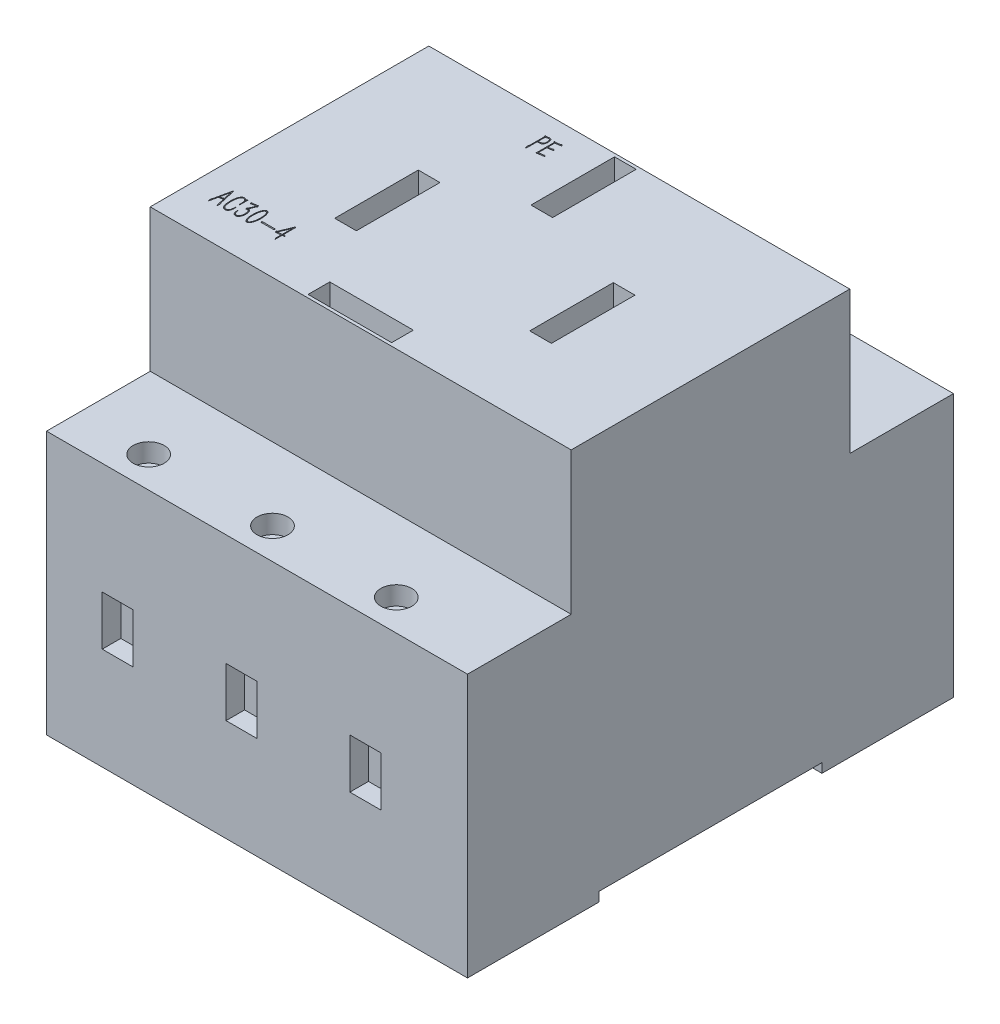
from build123d import *

# Parameters (mm, degrees)
EXTRUDE_1_DEPTH        = 34
SKETCH_2_R             = 2.5
CUT_EXTRUDE_1_DEPTH    = 3
SKETCH_3_W             = 5
SKETCH_3_H             = 8
CUT_EXTRUDE_2_DEPTH    = 3
PATTERN_LINEAR_1_COUNT = 3
PATTERN_LINEAR_1_PITCH = 20
SKETCH_5_R             = 3
CUT_EXTRUDE_3_DEPTH    = 3
SKETCH_6_W             = 5
SKETCH_6_H             = 8
CUT_EXTRUDE_4_DEPTH    = 3
SKETCH_8_W             = 3.5
SKETCH_8_H             = 13.5
SKETCH_8_W_2           = 13.5
SKETCH_8_H_2           = 3.5
CUT_EXTRUDE_5_DEPTH    = 5
SKETCH_9_W             = 2.164287236
SKETCH_9_H             = 0.217025357
CUT_EXTRUDE_6_DEPTH    = 0.3


with BuildPart() as part:
    # 草图1 → 凸台-拉伸1 (new, symmetric)
    with BuildSketch(Plane(origin=(0, 0, 0), x_dir=(0, 0, -1), z_dir=(1, 0, 0))):
        Polygon((-22.5, 32.75), (-22.5, 9.75), (-39.25, 9.75), (-39.25, -32.75), (-22.5, -32.75), (-18, -32.75), (-18, -31.25), (18, -31.25), (18, -32.75), (22.5, -32.75), (39.25, -32.75), (39.25, 9.75), (22.5, 9.75), (22.5, 32.75), align=None)
    extrude(amount=EXTRUDE_1_DEPTH, both=True)

    # 草图2 → 切除-拉伸1 (cut)
    with BuildSketch(Plane(origin=(0, 9.75, 0), x_dir=(1, 0, 0), z_dir=(0, 1, 0))):
        with Locations((-22.5, -34.25)):
            Circle(SKETCH_2_R)
    cut_extrude_1 = extrude(amount=-CUT_EXTRUDE_1_DEPTH, mode=Mode.SUBTRACT)

    # 草图3 → 切除-拉伸2 (cut)
    with BuildSketch(Plane.XY.offset(39.25)):
        with Locations((-22.5, -12.25)):
            Rectangle(SKETCH_3_W, SKETCH_3_H)
    cut_extrude_2 = extrude(amount=-CUT_EXTRUDE_2_DEPTH, mode=Mode.SUBTRACT)

    # 阵列(线性)1: 切除-拉伸1, 切除-拉伸2 ×3
    with Locations(*[(i * PATTERN_LINEAR_1_PITCH, 0, 0) for i in range(1, PATTERN_LINEAR_1_COUNT)]):
        add(cut_extrude_1, mode=Mode.SUBTRACT)
        add(cut_extrude_2, mode=Mode.SUBTRACT)

    # 草图5 → 切除-拉伸3 (cut)
    with BuildSketch(Plane(origin=(0, 9.75, 0), x_dir=(1, 0, 0), z_dir=(0, 1, 0))):
        with Locations((0, 30.875)):
            Circle(SKETCH_5_R)
    extrude(amount=-CUT_EXTRUDE_3_DEPTH, mode=Mode.SUBTRACT)

    # 草图6 → 切除-拉伸4 (cut)
    with BuildSketch(Plane(origin=(0, 0, -39.25), x_dir=(-1, 0, 0), z_dir=(0, 0, -1))):
        with Locations((0.051136376, -12.435750671)):
            Rectangle(SKETCH_6_W, SKETCH_6_H)
    extrude(amount=-CUT_EXTRUDE_4_DEPTH, mode=Mode.SUBTRACT)

    # 草图8 → 切除-拉伸5 (cut)
    with BuildSketch(Plane(origin=(0, 32.75, 0), x_dir=(1, 0, 0), z_dir=(0, 1, 0))):
        with Locations((-15.75, -2.45)):
            Rectangle(SKETCH_8_W, SKETCH_8_H)
        with Locations((15.75, -2.45)):
            Rectangle(SKETCH_8_W, SKETCH_8_H)
        with Locations((-1.75, 15.25)):
            Rectangle(SKETCH_8_W, SKETCH_8_H)
        with Locations((-2.25, -20.25)):
            Rectangle(SKETCH_8_W_2, SKETCH_8_H_2)
    extrude(amount=-CUT_EXTRUDE_5_DEPTH, mode=Mode.SUBTRACT)

    # 草图9 → 切除-拉伸6 (cut)
    # profile 1 of 8: a face of its own
    with BuildSketch(Plane(origin=(0, 32.75, 0), x_dir=(1, 0, 0), z_dir=(0, 1, 0))):
        with BuildLine():
            add(Edge.make_bspline(
                [(-11.801512892, 19.33613893), (-11.76294211, 19.342655436), (-11.688936026, 19.355158709), (-11.581529865, 19.376562509), (-11.477858928, 19.394623938), (-11.408798867, 19.399382697), (-11.374174302, 19.401768592)],
                knots=[0, 0, 0, 0, 1.084781132, 2.081378719, 3.038062992, 4, 4, 4, 4], degree=3))
            add(Edge.make_bspline(
                [(-11.374174302, 19.401768592), (-11.354271334, 19.402198433), (-11.316371238, 19.403016956), (-11.262702388, 19.397530609), (-11.214758221, 19.388597603), (-11.172376752, 19.372190528), (-11.133466975, 19.350019544), (-11.096191504, 19.320775276), (-11.059932038, 19.284191014), (-11.024572438, 19.239688211), (-10.991515103, 19.186866663), (-10.9641729, 19.123676623), (-10.940870822, 19.051338209), (-10.920150233, 18.943183187), (-10.899839451, 18.80686741), (-10.89282886, 18.672473876), (-10.892559414, 18.571919125), (-10.895522551, 18.503237962), (-10.901100118, 18.439693013), (-10.907813141, 18.39939236), (-10.911037716, 18.380034093)],
                knots=[0, 0, 0, 0, 0.834042403, 1.588219797, 2.258865872, 2.872645434, 3.484296274, 4.130763207, 4.85321558, 5.639635085, 6.510463327, 7.457868132, 8.519533185, 9.691141985, 12.070813463, 14.294972691, 15.327100164, 16.287155067, 17.177241371, 18, 18, 18, 18], degree=3))
            add(Edge.make_bspline(
                [(-10.911037716, 18.380034093), (-10.915144921, 18.35732753), (-10.923150953, 18.313066423), (-10.940955989, 18.249848862), (-10.959676457, 18.190387), (-10.983019434, 18.136657953), (-11.007543656, 18.087198913), (-11.035016811, 18.043685355), (-11.064165374, 18.004699441), (-11.106086544, 17.962316783), (-11.162392482, 17.91942711), (-11.236199063, 17.886400904), (-11.310833638, 17.870452486), (-11.359945005, 17.867582023), (-11.383869593, 17.866183678)],
                knots=[0, 0, 0, 0, 1.080384674, 2.105956013, 3.074594822, 3.998289199, 4.84730105, 5.658400013, 6.406150959, 7.122683501, 8.445750941, 9.696890862, 10.878041055, 12, 12, 12, 12], degree=3))
            Line((-11.383869593, 17.866183678), (-11.580012785, 17.856488387))
            Line((-11.580012785, 17.856488387), (-11.841785638, 17.82069039))
            Line((-11.841785638, 17.82069039), (-11.847006179, 16.471553377))
            add(Edge.make_bspline(
                [(-11.847006179, 16.471553377), (-11.847572448, 16.441714516), (-11.848591984, 16.387991316), (-11.852279411, 16.316448189), (-11.85363493, 16.262411034), (-11.858122951, 16.212503084), (-11.863305747, 16.157308561), (-11.870626625, 16.104768057), (-11.876293262, 16.06316781), (-11.882282145, 16.043637102), (-11.887599249, 16.027036289), (-11.895020625, 16.028148587), (-11.897720009, 16.028553164)],
                knots=[0, 0, 0, 0, 1.96874048, 3.54460707, 4.726507013, 5.532831549, 6.851459339, 8.37313705, 9.071482733, 9.549088405, 9.835989539, 10, 10, 10, 10], degree=3))
            add(Edge.make_bspline(
                [(-11.897720009, 16.028553164), (-11.898709, 16.029303976), (-11.902942126, 16.032517636), (-11.913283841, 16.039224631), (-11.923802464, 16.058545918), (-11.929396509, 16.074724582), (-11.932772214, 16.084487535)],
                knots=[0, 0, 0, 0, 0.220639879, 0.944392497, 2.156105254, 4, 4, 4, 4], degree=3))
            Line((-11.932772214, 16.084487535), (-11.958129128, 16.149371404))
            Line((-11.958129128, 16.149371404), (-12.018538248, 16.330598764))
            add(Edge.make_bspline(
                [(-12.018538248, 16.330598764), (-12.024172106, 16.348014379), (-12.033989073, 16.378360998), (-12.047628251, 16.417316391), (-12.0542973, 16.443616651), (-12.058082068, 16.464235447), (-12.049012575, 16.484656083), (-12.037607018, 16.51240828), (-12.021862101, 16.548753784), (-12.010562841, 16.593630284), (-11.999778319, 16.641656033), (-11.99000494, 16.692265163), (-11.983967342, 16.747839553), (-11.982383293, 16.800932542), (-11.983178747, 16.853410658), (-11.980643278, 16.905837152), (-11.980935206, 16.969512263), (-11.979199072, 17.015736331), (-11.978265502, 17.040592372)],
                knots=[0, 0, 0, 0, 1.21093634, 2.110050319, 2.719907809, 3.017552618, 3.464624392, 4.142243825, 5.027278712, 6.067997939, 7.196380019, 8.282686609, 9.473265847, 10.887508473, 11.791416163, 12.942313598, 14.355792079, 16, 16, 16, 16], degree=3))
            Line((-11.978265502, 17.040592372), (-11.967824419, 19.114638824))
            add(Edge.make_bspline(
                [(-11.967824419, 19.114638824), (-11.978592334, 19.136257358), (-11.998379777, 19.175984226), (-12.03075314, 19.22623651), (-12.055905597, 19.264511953), (-12.068685989, 19.294865592), (-12.072358542, 19.317644963), (-12.073303472, 19.330416787), (-12.073726827, 19.33613893)],
                knots=[0, 0, 0, 0, 1.750659444, 3.217064329, 4.333728491, 5.070582308, 5.583594197, 6, 6, 6, 6], degree=3))
            add(Edge.make_bspline(
                [(-12.073726827, 19.33613893), (-12.073054604, 19.339093059), (-12.071505722, 19.345899727), (-12.059600681, 19.351798366), (-12.043195974, 19.351929108), (-12.030480494, 19.351378261), (-12.023012998, 19.351054762)],
                knots=[0, 0, 0, 0, 0.599620471, 1.381597738, 2.462275397, 4, 4, 4, 4], degree=3))
            Line((-12.023012998, 19.351054762), (-11.973044961, 19.341359472))
            Line((-11.973044961, 19.341359472), (-11.801512892, 19.33613893))
        make_face()
        with BuildLine():
            Line((-11.841785638, 17.997443), (-11.504687833, 18.032495206))
            add(Edge.make_bspline(
                [(-11.504687833, 18.032495206), (-11.47431791, 18.035594752), (-11.410190295, 18.042139601), (-11.329161894, 18.056972584), (-11.263788393, 18.076694542), (-11.217398265, 18.096588681), (-11.176879835, 18.12313773), (-11.140781739, 18.154804634), (-11.110755277, 18.193991033), (-11.084698197, 18.239781101), (-11.066989473, 18.294491068), (-11.048284032, 18.377148349), (-11.034677461, 18.488735444), (-11.032806088, 18.579872999), (-11.031855956, 18.626145323)],
                knots=[0, 0, 0, 0, 1.242290402, 2.623158502, 3.343124827, 4.017967388, 4.668958523, 5.306607609, 5.962297971, 6.668776287, 7.439809609, 8.291324773, 10.117032856, 12, 12, 12, 12], degree=3))
            add(Edge.make_bspline(
                [(-11.031855956, 18.626145323), (-11.03384879, 18.65550179), (-11.037740313, 18.712827857), (-11.047479547, 18.795928488), (-11.059818711, 18.874215393), (-11.076468023, 18.946228742), (-11.093591872, 19.011467975), (-11.116517171, 19.066401367), (-11.140470655, 19.111898515), (-11.16872754, 19.148079721), (-11.2026425, 19.174588827), (-11.240199823, 19.197269387), (-11.285242723, 19.211435457), (-11.317181218, 19.21741227), (-11.333901556, 19.220541232)],
                knots=[0, 0, 0, 0, 1.450841259, 2.833141438, 4.12506739, 5.356415584, 6.477956507, 7.445537896, 8.28503356, 9.008768821, 9.688489171, 10.397114349, 11.160862483, 12, 12, 12, 12], degree=3))
            add(Edge.make_bspline(
                [(-11.333901556, 19.220541232), (-11.35627593, 19.221724928), (-11.401791031, 19.224132862), (-11.472072309, 19.219455749), (-11.545450389, 19.211150066), (-11.594998459, 19.200579203), (-11.620285532, 19.195184317)],
                knots=[0, 0, 0, 0, 0.931107193, 1.894105981, 2.925247858, 4, 4, 4, 4], degree=3))
            Line((-11.620285532, 19.195184317), (-11.826869806, 19.149691029))
            Line((-11.826869806, 19.149691029), (-11.841785638, 17.997443))
        make_face(mode=Mode.SUBTRACT)
    # profile 2 of 8: a face of its own
    with BuildSketch(Plane(origin=(0, 32.75, 0), x_dir=(1, 0, 0), z_dir=(0, 1, 0))):
        with BuildLine():
            Line((-10.23907948, 19.074366077), (-10.23907948, 17.966865544))
            Line((-10.23907948, 17.966865544), (-9.81621564, 18.022054123))
            add(Edge.make_bspline(
                [(-9.81621564, 18.022054123), (-9.801041342, 18.024479515), (-9.767379117, 18.029859935), (-9.715304394, 18.039609097), (-9.663312968, 18.051556598), (-9.616640884, 18.06412596), (-9.576614209, 18.078448063), (-9.540095392, 18.092026131), (-9.5071498, 18.107872103), (-9.488155583, 18.121481137), (-9.479117835, 18.127956531)],
                knots=[0, 0, 0, 0, 1.0349619, 2.295929578, 3.567192849, 4.627442236, 5.548769194, 6.428698295, 7.252349857, 8, 8, 8, 8], degree=3))
            Line((-9.479117835, 18.127956531), (-9.433624547, 18.153313446))
            Line((-9.433624547, 18.153313446), (-9.287449393, 18.007138291))
            add(Edge.make_bspline(
                [(-9.287449393, 18.007138291), (-9.280713445, 17.998671779), (-9.269519366, 17.984601779), (-9.263238291, 17.961040892), (-9.268612175, 17.943152474), (-9.279172887, 17.930327369), (-9.294765251, 17.922072224), (-9.306482145, 17.921617625), (-9.312806307, 17.921372257)],
                knots=[0, 0, 0, 0, 1.598367029, 2.656232682, 3.46306406, 4.276633186, 5.069817383, 6, 6, 6, 6], degree=3))
            Line((-9.312806307, 17.921372257), (-10.23907948, 17.790858726))
            Line((-10.23907948, 17.790858726), (-10.23907948, 16.426805881))
            Line((-10.23907948, 16.426805881), (-9.488813126, 16.531962497))
            add(Edge.make_bspline(
                [(-9.488813126, 16.531962497), (-9.477093061, 16.534280075), (-9.453411774, 16.538962917), (-9.417945122, 16.549256878), (-9.382900938, 16.564717842), (-9.359730101, 16.576592395), (-9.347858513, 16.582676326)],
                knots=[0, 0, 0, 0, 0.952294954, 1.924184826, 2.936455269, 4, 4, 4, 4], degree=3))
            Line((-9.347858513, 16.582676326), (-9.303111016, 16.608033241))
            Line((-9.303111016, 16.608033241), (-9.162156403, 16.451417004))
            add(Edge.make_bspline(
                [(-9.162156403, 16.451417004), (-9.155046236, 16.44307272), (-9.143308388, 16.429297524), (-9.140214671, 16.405019594), (-9.146433369, 16.389619396), (-9.153849985, 16.376836589), (-9.171112176, 16.371504435), (-9.183816909, 16.371119247), (-9.191988067, 16.370871511)],
                knots=[0, 0, 0, 0, 1.609002555, 2.656228529, 3.444229916, 4.084037918, 4.767732536, 6, 6, 6, 6], degree=3))
            Line((-9.191988067, 16.370871511), (-9.267313019, 16.366396761))
            add(Edge.make_bspline(
                [(-9.267313019, 16.366396761), (-9.288450951, 16.364481048), (-9.334004815, 16.360352539), (-9.406607839, 16.352132073), (-9.488315642, 16.341287819), (-9.5788937, 16.329754683), (-9.678541926, 16.315268331), (-9.786965954, 16.299076574), (-9.904452391, 16.280035913), (-9.985754567, 16.267178454), (-10.028020456, 16.260494353)],
                knots=[0, 0, 0, 0, 0.663087027, 1.429003413, 2.282528104, 3.23817949, 4.281637937, 5.428377517, 6.663111914, 8, 8, 8, 8], degree=3))
            Line((-10.028020456, 16.260494353), (-10.259215853, 16.220221607))
            add(Edge.make_bspline(
                [(-10.259215853, 16.220221607), (-10.277231429, 16.213225519), (-10.309282583, 16.200778919), (-10.35345326, 16.18784755), (-10.391266686, 16.189721699), (-10.421917376, 16.20825022), (-10.436287489, 16.246564945), (-10.432763414, 16.274404183), (-10.430747922, 16.290326017)],
                knots=[0, 0, 0, 0, 1.380317655, 2.455695842, 3.256886563, 4.014496814, 4.864449804, 6, 6, 6, 6], degree=3))
            add(Edge.make_bspline(
                [(-10.430747922, 16.290326017), (-10.429903309, 16.296080674), (-10.427502568, 16.312437799), (-10.416465324, 16.340734997), (-10.406584803, 16.377808534), (-10.396300136, 16.422424491), (-10.390200792, 16.47940929), (-10.387075635, 16.52250983), (-10.385254635, 16.547624121)],
                knots=[0, 0, 0, 0, 0.398372487, 1.132340191, 2.07227747, 3.032898756, 4.271097258, 6, 6, 6, 6], degree=3))
            Line((-10.385254635, 16.547624121), (-10.385254635, 16.643085446))
            add(Edge.make_bspline(
                [(-10.385254635, 16.643085446), (-10.38443193, 16.657003576), (-10.382919105, 16.682596824), (-10.381923247, 16.717431905), (-10.379716075, 16.745485089), (-10.379937069, 16.76191217), (-10.380034093, 16.769124228)],
                knots=[0, 0, 0, 0, 1.325956836, 2.438225671, 3.314326982, 4, 4, 4, 4], degree=3))
            Line((-10.380034093, 16.769124228), (-10.385254635, 19.074366077))
            add(Edge.make_bspline(
                [(-10.385254635, 19.074366077), (-10.395113663, 19.086120144), (-10.414935997, 19.109752598), (-10.445235063, 19.142859208), (-10.469382458, 19.174867434), (-10.490995064, 19.200402197), (-10.503400137, 19.224504921), (-10.510310243, 19.247398612), (-10.508935386, 19.267150268), (-10.51216073, 19.28657367), (-10.491988276, 19.300625297), (-10.476122047, 19.297741963), (-10.465800128, 19.295866184)],
                knots=[0, 0, 0, 0, 1.53483591, 3.085905438, 4.484103556, 5.548538687, 6.41610315, 7.18824125, 7.885014218, 8.432694789, 8.98037536, 10, 10, 10, 10], degree=3))
            Line((-10.465800128, 19.295866184), (-10.370338802, 19.280950352))
            add(Edge.make_bspline(
                [(-10.370338802, 19.280950352), (-10.349221346, 19.278052043), (-10.312266036, 19.272980035), (-10.263567405, 19.268294166), (-10.227270348, 19.266355491), (-10.207244909, 19.269277862), (-10.198806733, 19.270509269)],
                knots=[0, 0, 0, 0, 1.482629705, 2.594585164, 3.407796403, 4, 4, 4, 4], degree=3))
            Line((-10.198806733, 19.270509269), (-10.183890901, 19.270509269))
            add(Edge.make_bspline(
                [(-10.183890901, 19.270509269), (-10.164751007, 19.27076203), (-10.128702466, 19.271238086), (-10.077114158, 19.271855568), (-10.030687618, 19.277033347), (-10.001629363, 19.283216899), (-9.987747709, 19.286170893)],
                knots=[0, 0, 0, 0, 1.164559704, 2.193360016, 3.136935425, 4, 4, 4, 4], degree=3))
            Line((-9.987747709, 19.286170893), (-9.790858726, 19.321223098))
            add(Edge.make_bspline(
                [(-9.790858726, 19.321223098), (-9.771452699, 19.324103947), (-9.73704664, 19.32921157), (-9.688947787, 19.337736855), (-9.64464825, 19.348252048), (-9.599556773, 19.361548952), (-9.554293433, 19.375241502), (-9.513605573, 19.390151993), (-9.480398863, 19.404973711), (-9.461865164, 19.416753854), (-9.453760921, 19.421904965)],
                knots=[0, 0, 0, 0, 1.329594741, 2.357314772, 3.309480275, 4.413369338, 5.543056356, 6.5132362, 7.349881783, 8, 8, 8, 8], degree=3))
            Line((-9.453760921, 19.421904965), (-9.408267633, 19.451736629))
            Line((-9.408267633, 19.451736629), (-9.26283827, 19.301086725))
            add(Edge.make_bspline(
                [(-9.26283827, 19.301086725), (-9.257553966, 19.29238351), (-9.248938432, 19.278193779), (-9.241131912, 19.257603875), (-9.244864544, 19.241102597), (-9.25491261, 19.229315982), (-9.269916549, 19.221358222), (-9.28137786, 19.220824151), (-9.287449393, 19.220541232)],
                knots=[0, 0, 0, 0, 1.627163788, 2.652929776, 3.381477164, 4.196017905, 5.044355687, 6, 6, 6, 6], degree=3))
            Line((-9.287449393, 19.220541232), (-9.367994886, 19.210100149))
            add(Edge.make_bspline(
                [(-9.367994886, 19.210100149), (-9.385398717, 19.207878413), (-9.417973734, 19.203719956), (-9.463701931, 19.19764769), (-9.503004771, 19.192614943), (-9.535748344, 19.187829338), (-9.56214716, 19.184968719), (-9.582039038, 19.182773759), (-9.595702658, 19.18119398), (-9.6026701, 19.180511902), (-9.605156616, 19.180268485)],
                knots=[0, 0, 0, 0, 1.761538881, 3.297099284, 4.631434889, 5.739811667, 6.619076803, 7.297127464, 7.749161238, 8, 8, 8, 8], degree=3))
            Line((-9.605156616, 19.180268485), (-10.23907948, 19.074366077))
        make_face()
    # profile 3 of 8: a face of its own
    with BuildSketch(Plane(origin=(0, 32.75, 0), x_dir=(1, 0, 0), z_dir=(0, 1, 0))):
        with BuildLine():
            Line((-29.153846154, -15.517259749), (-29.838482847, -15.682825485))
            Line((-29.838482847, -15.682825485), (-29.999573833, -16.433091839))
            Line((-29.999573833, -16.433091839), (-30.075644577, -16.815682932))
            Line((-30.075644577, -16.815682932), (-30.105476241, -16.936501172))
            add(Edge.make_bspline(
                [(-30.105476241, -16.936501172), (-30.10864397, -16.945059256), (-30.113986048, -16.959491663), (-30.124037779, -16.97647154), (-30.13506828, -16.98490966), (-30.14738396, -16.98668845), (-30.156623365, -16.976009255), (-30.162117538, -16.962475291), (-30.163762051, -16.942614008), (-30.168331734, -16.916755356), (-30.171189485, -16.879763732), (-30.174468618, -16.851712187), (-30.176326444, -16.835819305)],
                knots=[0, 0, 0, 0, 1.226577759, 2.068508672, 2.595953142, 3.064162245, 3.560072257, 4.322224954, 5.029865969, 6.20926766, 7.852322798, 10, 10, 10, 10], degree=3))
            Line((-30.176326444, -16.835819305), (-30.200937567, -16.624760281))
            add(Edge.make_bspline(
                [(-30.200937567, -16.624760281), (-30.202528405, -16.607368105), (-30.205366473, -16.576340333), (-30.207860132, -16.535289216), (-30.208022043, -16.505671284), (-30.206586828, -16.480893098), (-30.199249484, -16.457460972), (-30.190532766, -16.441402394), (-30.186021734, -16.433091839)],
                knots=[0, 0, 0, 0, 1.603576797, 2.86079302, 3.773774944, 4.323462854, 5.1323669, 6, 6, 6, 6], degree=3))
            Line((-30.186021734, -16.433091839), (-30.16066482, -16.387598551))
            add(Edge.make_bspline(
                [(-30.16066482, -16.387598551), (-30.155234051, -16.375749704), (-30.142264208, -16.347452114), (-30.125841933, -16.295357842), (-30.108345759, -16.227530288), (-30.090715847, -16.149461978), (-30.073434547, -16.073859556), (-30.059628871, -16.012257796), (-30.04903273, -15.971395967), (-30.042141348, -15.951292584), (-30.03984658, -15.944598338)],
                knots=[0, 0, 0, 0, 0.679694972, 1.623257572, 2.844174753, 4.335796169, 5.799225578, 6.891200865, 7.630779852, 8, 8, 8, 8], degree=3))
            Line((-30.03984658, -15.944598338), (-29.521521415, -13.543895163))
            Line((-29.521521415, -13.543895163), (-29.451417004, -13.543895163))
            Line((-29.451417004, -13.543895163), (-28.962923503, -15.702961858))
            Line((-28.962923503, -15.702961858), (-28.902514383, -15.95503942))
            add(Edge.make_bspline(
                [(-28.902514383, -15.95503942), (-28.896454785, -15.98341577), (-28.885584754, -16.034318782), (-28.869043657, -16.101920209), (-28.855477696, -16.152543791), (-28.845938582, -16.180301036), (-28.842105263, -16.191455359)],
                knots=[0, 0, 0, 0, 1.425899692, 2.557855139, 3.420470246, 4, 4, 4, 4], degree=3))
            Line((-28.842105263, -16.191455359), (-28.807053058, -16.286916684))
            add(Edge.make_bspline(
                [(-28.807053058, -16.286916684), (-28.803018292, -16.300900397), (-28.795667104, -16.326378181), (-28.783109763, -16.360097705), (-28.770768714, -16.386133792), (-28.755055502, -16.40806158), (-28.739116806, -16.42451921), (-28.728115071, -16.441586532), (-28.726725188, -16.457519374), (-28.728652254, -16.472125844), (-28.730710195, -16.490728918), (-28.731711538, -16.514153121), (-28.734369821, -16.546426333), (-28.735544096, -16.570809028), (-28.736202855, -16.584487535)],
                knots=[0, 0, 0, 0, 1.645080438, 2.997272953, 4.065812928, 4.892545225, 6.029861332, 6.67147811, 7.124734071, 7.80170629, 8.338742145, 9.240009017, 10.451666043, 12, 12, 12, 12], degree=3))
            Line((-28.736202855, -16.584487535), (-28.756339229, -16.810462391))
            Line((-28.756339229, -16.810462391), (-28.766780311, -16.896228425))
            add(Edge.make_bspline(
                [(-28.766780311, -16.896228425), (-28.767276735, -16.905954831), (-28.76815915, -16.923243947), (-28.772413177, -16.9455144), (-28.775198303, -16.961680016), (-28.781065911, -16.973375317), (-28.792213852, -16.979158277), (-28.806034167, -16.975124678), (-28.816656291, -16.96114578), (-28.820012176, -16.948875905), (-28.82196889, -16.941721713)],
                knots=[0, 0, 0, 0, 1.663187075, 2.956388731, 3.874273883, 4.464983498, 5.130530035, 5.83179128, 6.735783313, 8, 8, 8, 8], degree=3))
            Line((-28.82196889, -16.941721713), (-28.857021095, -16.74035798))
            Line((-28.857021095, -16.74035798), (-29.153846154, -15.517259749))
        make_face()
        with BuildLine():
            Line((-29.164287236, -15.441189005), (-29.486469209, -14.027168123))
            Line((-29.486469209, -14.027168123), (-29.813871724, -15.506818666))
            add(Edge.make_bspline(
                [(-29.813871724, -15.506818666), (-29.785469746, -15.502440871), (-29.736436445, -15.494883025), (-29.66809484, -15.479873252), (-29.603414001, -15.462106351), (-29.545976991, -15.446213948), (-29.498533158, -15.430091389), (-29.467534101, -15.419423278), (-29.443983916, -15.408400165), (-29.431457775, -15.400042808), (-29.426060089, -15.396441509)],
                knots=[0, 0, 0, 0, 1.70172219, 2.937860729, 4.141475294, 5.674569601, 6.46612829, 7.108957565, 7.616037637, 8, 8, 8, 8], degree=3))
            Line((-29.426060089, -15.396441509), (-29.300021308, -15.310675474))
            Line((-29.300021308, -15.310675474), (-29.164287236, -15.441189005))
        make_face(mode=Mode.SUBTRACT)
    # profile 4 of 8: a face of its own
    with BuildSketch(Plane(origin=(0, 32.75, 0), x_dir=(1, 0, 0), z_dir=(0, 1, 0))):
        with BuildLine():
            Line((-27.154378862, -13.95631792), (-27.118580865, -13.659492862))
            Line((-27.118580865, -13.659492862), (-27.043255913, -13.659492862))
            Line((-27.043255913, -13.659492862), (-27.043255913, -15.003409333))
            Line((-27.043255913, -15.003409333), (-27.138717238, -15.003409333))
            add(Edge.make_bspline(
                [(-27.138717238, -15.003409333), (-27.138847848, -14.979044476), (-27.139121111, -14.928068106), (-27.142037466, -14.846552828), (-27.143899059, -14.753560188), (-27.147067392, -14.648656873), (-27.150044643, -14.536336662), (-27.161034693, -14.421325542), (-27.177835803, -14.305088994), (-27.203475464, -14.188496192), (-27.237192223, -14.07606274), (-27.277029876, -13.990486403), (-27.314226621, -13.930399112), (-27.344696643, -13.891337922), (-27.378660136, -13.858056011), (-27.42726281, -13.821844688), (-27.493643297, -13.785362539), (-27.552385557, -13.775029591), (-27.581717452, -13.769870019)],
                knots=[0, 0, 0, 0, 0.822473136, 1.720785642, 2.753326599, 3.962261781, 5.264018637, 6.545024146, 7.860049611, 9.226346671, 10.572050264, 11.814683136, 12.399128484, 12.954850798, 13.483022901, 13.998303406, 15.000488703, 16, 16, 16, 16], degree=3))
            add(Edge.make_bspline(
                [(-27.581717452, -13.769870019), (-27.604143012, -13.769271775), (-27.648899814, -13.768077803), (-27.715441677, -13.78153376), (-27.7795427, -13.806647815), (-27.841041957, -13.843038343), (-27.899627026, -13.88980444), (-27.951586298, -13.949631437), (-28.000993572, -14.018313232), (-28.041970529, -14.098736511), (-28.078282205, -14.185169663), (-28.112059777, -14.275097553), (-28.138257563, -14.368823702), (-28.166595397, -14.496167199), (-28.191791887, -14.654143397), (-28.209894779, -14.838036678), (-28.219357046, -15.009759192), (-28.222687096, -15.169969078), (-28.219397926, -15.323937552), (-28.213932839, -15.425540075), (-28.211165566, -15.476987002)],
                knots=[0, 0, 0, 0, 0.603095173, 1.203653813, 1.814626149, 2.451293107, 3.123130818, 3.825388984, 4.580186105, 5.398460658, 6.251023789, 7.107448911, 7.985514538, 8.871470416, 10.622993602, 12.29317529, 13.850163291, 15.257553743, 16.61134915, 18, 18, 18, 18], degree=3))
            add(Edge.make_bspline(
                [(-28.211165566, -15.476987002), (-28.207141866, -15.522995358), (-28.198908502, -15.617138444), (-28.185205272, -15.736565277), (-28.169361046, -15.837660378), (-28.153651215, -15.920968012), (-28.134068867, -16.01118983), (-28.112097319, -16.104859171), (-28.087368362, -16.194473438), (-28.064149264, -16.273940978), (-28.0407446, -16.338840519), (-28.009948785, -16.405831128), (-27.966377041, -16.476136539), (-27.909774013, -16.551912506), (-27.846301728, -16.614607183), (-27.778252898, -16.662330049), (-27.702330352, -16.690068949), (-27.649313201, -16.693233701), (-27.621990198, -16.694864692)],
                knots=[0, 0, 0, 0, 1.515526627, 3.101096572, 3.943353373, 4.87293365, 5.882541642, 6.972773351, 8.029529644, 8.932786276, 9.68898916, 10.291221641, 11.348890653, 12.39638072, 13.388602443, 14.264213047, 15.105442077, 16, 16, 16, 16], degree=3))
            add(Edge.make_bspline(
                [(-27.621990198, -16.694864692), (-27.596527409, -16.695208185), (-27.544674824, -16.695907677), (-27.467443973, -16.676266369), (-27.39247369, -16.644890815), (-27.322446322, -16.598563452), (-27.260660198, -16.537059595), (-27.208112807, -16.460530153), (-27.166442554, -16.369383439), (-27.13764843, -16.265259683), (-27.114417756, -16.152922142), (-27.0993168, -16.057057999), (-27.088631024, -15.984603481), (-27.081716929, -15.941164633), (-27.077381182, -15.908790746), (-27.074836991, -15.891148616), (-27.073833369, -15.884189218)],
                knots=[0, 0, 0, 0, 0.974493461, 1.984464659, 3.032762083, 4.086915356, 5.187622472, 6.361151533, 7.634420725, 9.018373663, 10.501751059, 12.040324543, 12.745324753, 13.31527632, 13.729892907, 14, 14, 14, 14], degree=3))
            Line((-27.073833369, -15.884189218), (-27.048476454, -15.617941615))
            Line((-27.048476454, -15.617941615), (-26.967930961, -15.622416365))
            add(Edge.make_bspline(
                [(-26.967930961, -15.622416365), (-26.967830566, -15.647277054), (-26.96764784, -15.692525025), (-26.9687584, -15.754169806), (-26.968975964, -15.803166407), (-26.970973755, -15.843168215), (-26.97227045, -15.880744115), (-26.975535527, -15.922752306), (-26.979959326, -15.972728249), (-26.987927194, -16.04648763), (-26.995948906, -16.134889966), (-27.00717445, -16.233853206), (-27.023886367, -16.330548493), (-27.055245267, -16.431476186), (-27.09841565, -16.537427687), (-27.14717708, -16.621968331), (-27.193658318, -16.684516727), (-27.234338133, -16.726189058), (-27.279478025, -16.764207942), (-27.329787196, -16.79633569), (-27.382877233, -16.82334811), (-27.438190392, -16.842512316), (-27.494270908, -16.856907128), (-27.532657255, -16.859751443), (-27.551885787, -16.86117622)],
                knots=[0, 0, 0, 0, 1.082557886, 1.97032136, 2.684891572, 3.215786613, 3.714233695, 4.322010655, 5.050226996, 5.899051791, 7.552532718, 8.915438272, 10.236158893, 11.818471953, 13.507262255, 15.209909354, 16.052150521, 16.894322113, 17.739826851, 18.616631911, 19.488074199, 20.326969254, 21.161943562, 22, 22, 22, 22], degree=3))
            add(Edge.make_bspline(
                [(-27.551885787, -16.86117622), (-27.584050628, -16.862585178), (-27.649565549, -16.865455014), (-27.746210279, -16.843418682), (-27.836608298, -16.808503478), (-27.905440284, -16.768347901), (-27.954540688, -16.728515916), (-27.989551677, -16.691874136), (-28.024934462, -16.650134448), (-28.058813171, -16.601399335), (-28.092696464, -16.546904213), (-28.124262394, -16.485821366), (-28.154841922, -16.419016663), (-28.195779572, -16.320406991), (-28.239917752, -16.183864194), (-28.275126669, -16.038146746), (-28.298806336, -15.912130644), (-28.313059337, -15.809238509), (-28.326783779, -15.700396125), (-28.341312004, -15.548809972), (-28.353284604, -15.360340153), (-28.359405029, -15.137664793), (-28.35295544, -14.91702744), (-28.335595764, -14.770629558), (-28.326763264, -14.696143192)],
                knots=[0, 0, 0, 0, 0.828879423, 1.68830212, 2.536676829, 3.328986324, 3.73541648, 4.167069034, 4.63682846, 5.148487351, 5.699502401, 6.294435402, 6.924061178, 7.598240742, 9.053084533, 10.627089957, 11.470192478, 12.366164513, 13.311378798, 14.305576584, 16.301598498, 18.191207909, 20.062109376, 22, 22, 22, 22], degree=3))
            add(Edge.make_bspline(
                [(-28.326763264, -14.696143192), (-28.316684952, -14.621572919), (-28.296627654, -14.4731673), (-28.251872225, -14.293125126), (-28.209270715, -14.157641548), (-28.176168816, -14.067297649), (-28.141019476, -13.988695545), (-28.104984339, -13.920173424), (-28.066294568, -13.86049449), (-28.025616892, -13.80689251), (-27.980194445, -13.760843292), (-27.933968265, -13.719981273), (-27.88754957, -13.686636805), (-27.844886975, -13.658971495), (-27.807311696, -13.636621594), (-27.760656473, -13.617115821), (-27.699222561, -13.602097789), (-27.64868657, -13.603541579), (-27.621990198, -13.604304283)],
                knots=[0, 0, 0, 0, 2.546659555, 5.068220541, 6.268960188, 7.35572531, 8.324149365, 9.182807276, 9.974388089, 10.730435642, 11.456747585, 12.160764052, 12.817438768, 13.389505863, 13.883390408, 14.294592413, 15.099093679, 16, 16, 16, 16], degree=3))
            add(Edge.make_bspline(
                [(-27.621990198, -13.604304283), (-27.594691369, -13.608978906), (-27.538740769, -13.618559829), (-27.456921855, -13.64857607), (-27.376119375, -13.69001941), (-27.306179263, -13.74852705), (-27.244316757, -13.808975937), (-27.213427117, -13.854634298), (-27.199126358, -13.875772427)],
                knots=[0, 0, 0, 0, 0.959137923, 1.965811105, 3.01152559, 4.09188384, 5.116612916, 6, 6, 6, 6], degree=3))
            Line((-27.199126358, -13.875772427), (-27.154378862, -13.95631792))
        make_face()
    # profile 5 of 8: a face of its own
    with BuildSketch(Plane(origin=(0, 32.75, 0), x_dir=(1, 0, 0), z_dir=(0, 1, 0))):
        with BuildLine():
            add(Edge.make_bspline(
                [(-25.949179629, -14.832623056), (-25.938007995, -14.809496011), (-25.916487303, -14.764944784), (-25.885097354, -14.700591841), (-25.855813392, -14.641507765), (-25.830766768, -14.586681307), (-25.80741193, -14.537321203), (-25.786611422, -14.492899036), (-25.768638382, -14.453400283), (-25.749716567, -14.409548209), (-25.730091755, -14.36380032), (-25.711093289, -14.318991432), (-25.69727738, -14.286983409), (-25.690134527, -14.270050493), (-25.687406776, -14.263584061)],
                knots=[0, 0, 0, 0, 1.475873638, 2.843077615, 4.114458223, 5.26483622, 6.306479236, 7.252326145, 8.083448402, 8.799989154, 9.996708352, 10.943956596, 11.596712522, 12, 12, 12, 12], degree=3))
            Line((-25.687406776, -14.263584061), (-25.526315789, -13.83549968))
            add(Edge.make_bspline(
                [(-25.526315789, -13.83549968), (-25.561351946, -13.838928371), (-25.637799113, -13.846409606), (-25.73535917, -13.852349721), (-25.816476861, -13.856675542), (-25.872137467, -13.861339664), (-25.920877275, -13.865699087), (-25.950924265, -13.869015711), (-25.964841253, -13.870551886)],
                knots=[0, 0, 0, 0, 1.440114021, 3.142257811, 3.998086789, 4.76330671, 5.427195687, 6, 6, 6, 6], degree=3))
            Line((-25.964841253, -13.870551886), (-26.115491157, -13.8959088))
            add(Edge.make_bspline(
                [(-26.115491157, -13.8959088), (-26.122222602, -13.897323976), (-26.140587823, -13.901184961), (-26.174550787, -13.911728117), (-26.223463727, -13.924693766), (-26.260693143, -13.935356299), (-26.281802685, -13.941402088)],
                knots=[0, 0, 0, 0, 0.478461291, 1.305373098, 2.472113022, 4, 4, 4, 4], degree=3))
            Line((-26.281802685, -13.941402088), (-26.331770722, -13.961538462))
            Line((-26.331770722, -13.961538462), (-26.457809504, -13.77509056))
            add(Edge.make_bspline(
                [(-26.457809504, -13.77509056), (-26.463131701, -13.767790732), (-26.472217261, -13.755329146), (-26.479759894, -13.737993825), (-26.485358692, -13.72595056), (-26.480340656, -13.713822976), (-26.460497867, -13.715641528), (-26.44551626, -13.726278227), (-26.42638056, -13.736512097), (-26.404364508, -13.737951427), (-26.377673257, -13.739517838), (-26.358110909, -13.73647747), (-26.347432346, -13.734817814)],
                knots=[0, 0, 0, 0, 1.323589942, 2.259509366, 2.829398404, 3.190947808, 3.965341466, 5.19662492, 6.050472624, 7.088782, 8.410843841, 10, 10, 10, 10], degree=3))
            Line((-26.347432346, -13.734817814), (-26.186341359, -13.729597273))
            Line((-26.186341359, -13.729597273), (-25.551672704, -13.65427232))
            Line((-25.551672704, -13.65427232), (-25.501704667, -13.608779033))
            Line((-25.501704667, -13.608779033), (-25.46143192, -13.568506286))
            add(Edge.make_bspline(
                [(-25.46143192, -13.568506286), (-25.460182944, -13.569993019), (-25.455062836, -13.576087798), (-25.444040159, -13.590590628), (-25.424440297, -13.613891368), (-25.409621929, -13.633308961), (-25.4010228, -13.64457703)],
                knots=[0, 0, 0, 0, 0.23984028, 0.983211964, 2.249351781, 4, 4, 4, 4], degree=3))
            Line((-25.4010228, -13.64457703), (-25.304815683, -13.76539527))
            add(Edge.make_bspline(
                [(-25.304815683, -13.76539527), (-25.298355223, -13.773783312), (-25.287618963, -13.787722909), (-25.279653937, -13.810016338), (-25.287815652, -13.82512065), (-25.299217075, -13.838067786), (-25.317698844, -13.853618288), (-25.332342046, -13.864439317), (-25.34061368, -13.870551886)],
                knots=[0, 0, 0, 0, 1.419029252, 2.358201718, 2.827787952, 3.596253847, 4.642174893, 6, 6, 6, 6], degree=3))
            Line((-25.34061368, -13.870551886), (-25.395802259, -13.916045174))
            add(Edge.make_bspline(
                [(-25.395802259, -13.916045174), (-25.411930793, -13.956578471), (-25.442532423, -14.033484713), (-25.486623308, -14.142935579), (-25.526968269, -14.240253133), (-25.56239394, -14.326287286), (-25.594932917, -14.400060178), (-25.621795766, -14.462658281), (-25.645981072, -14.512879656), (-25.660774072, -14.542278227), (-25.667270403, -14.555188579)],
                knots=[0, 0, 0, 0, 1.507300768, 2.859891598, 4.076963614, 5.147345159, 6.074452096, 6.862861548, 7.500626815, 8, 8, 8, 8], degree=3))
            Line((-25.667270403, -14.555188579), (-25.818666098, -14.842318346))
            add(Edge.make_bspline(
                [(-25.818666098, -14.842318346), (-25.80077064, -14.8408895), (-25.76649768, -14.838153008), (-25.71419291, -14.832929177), (-25.657203857, -14.84011451), (-25.607219528, -14.860105118), (-25.564691589, -14.884771996), (-25.530613943, -14.909409359), (-25.498057892, -14.941431036), (-25.464860727, -14.979074857), (-25.431586015, -15.024004711), (-25.400998082, -15.078423989), (-25.369156435, -15.140565939), (-25.329334787, -15.235269274), (-25.2863058, -15.361984268), (-25.260162087, -15.52113901), (-25.247245092, -15.680595693), (-25.245348784, -15.786714377), (-25.244406563, -15.839441722)],
                knots=[0, 0, 0, 0, 0.660541429, 1.265053373, 1.928435853, 2.750244091, 3.225390118, 3.735570922, 4.291687282, 4.900607759, 5.580848831, 6.342918567, 7.193367346, 8.147740655, 10.119512469, 12.097611575, 14.061014616, 16, 16, 16, 16], degree=3))
            add(Edge.make_bspline(
                [(-25.244406563, -15.839441722), (-25.246396925, -15.880721601), (-25.250177974, -15.959140118), (-25.259315874, -16.069951499), (-25.272952287, -16.167167426), (-25.292811388, -16.276769954), (-25.327834368, -16.397859178), (-25.371100816, -16.509575171), (-25.412181655, -16.590060186), (-25.44680367, -16.643429303), (-25.484724653, -16.6911748), (-25.525475694, -16.732957284), (-25.567865185, -16.767293719), (-25.609006124, -16.796824178), (-25.650636578, -16.817695346), (-25.704530928, -16.835131144), (-25.770391111, -16.847149747), (-25.822845914, -16.849557621), (-25.848497763, -16.850735137)],
                knots=[0, 0, 0, 0, 1.512752116, 2.8737433, 4.067977017, 5.104892351, 6.948544146, 8.672095895, 9.482011449, 10.251829035, 10.996496654, 11.710742831, 12.38300564, 12.991319199, 13.561044299, 14.079002633, 15.060579187, 16, 16, 16, 16], degree=3))
            add(Edge.make_bspline(
                [(-25.848497763, -16.850735137), (-25.870377698, -16.851108091), (-25.912472183, -16.85182561), (-25.973529129, -16.846855109), (-26.029138583, -16.83547854), (-26.081291016, -16.820002461), (-26.13013346, -16.795528833), (-26.17678744, -16.760568347), (-26.22375304, -16.717518531), (-26.26878365, -16.664688541), (-26.309996278, -16.604162867), (-26.346031514, -16.537213204), (-26.375971834, -16.464787362), (-26.405736289, -16.361715429), (-26.430964188, -16.229916753), (-26.435458607, -16.123212995), (-26.43767313, -16.070637119)],
                knots=[0, 0, 0, 0, 0.828828519, 1.594571005, 2.314948186, 2.97625877, 3.650192192, 4.371738268, 5.178272596, 6.059897072, 6.995131469, 7.947518938, 8.935744196, 9.957858231, 12.008325587, 14, 14, 14, 14], degree=3))
            Line((-26.43767313, -16.070637119), (-26.442893671, -15.874493927))
            Line((-26.442893671, -15.874493927), (-26.387705093, -15.874493927))
            add(Edge.make_bspline(
                [(-26.387705093, -15.874493927), (-26.383484895, -15.903580402), (-26.375402843, -15.959283581), (-26.363646568, -16.039649112), (-26.351470256, -16.112907738), (-26.337747893, -16.199602325), (-26.314893736, -16.296950996), (-26.276391451, -16.401723578), (-26.224176959, -16.4902498), (-26.162870717, -16.563201481), (-26.091169414, -16.616153574), (-26.014411982, -16.649554655), (-25.936182303, -16.665325211), (-25.884350078, -16.665129149), (-25.858938845, -16.665033028)],
                knots=[0, 0, 0, 0, 0.994021113, 1.903638599, 2.746793397, 3.505624798, 4.871908371, 6.122639036, 7.264652637, 8.331625701, 9.323760524, 10.250011688, 11.142051883, 12, 12, 12, 12], degree=3))
            add(Edge.make_bspline(
                [(-25.858938845, -16.665033028), (-25.83849589, -16.663270178), (-25.798456646, -16.659817489), (-25.740395396, -16.646672736), (-25.686700419, -16.624243739), (-25.636506286, -16.595561937), (-25.59132656, -16.558159879), (-25.550664563, -16.514088042), (-25.516229052, -16.461731756), (-25.477636545, -16.381577308), (-25.440130551, -16.271073813), (-25.41191027, -16.130715034), (-25.393546871, -15.987545354), (-25.384919846, -15.845092224), (-25.383744369, -15.704751157), (-25.395284256, -15.612902298), (-25.4010228, -15.567227786)],
                knots=[0, 0, 0, 0, 0.647840119, 1.268849254, 1.871153999, 2.479976942, 3.088343857, 3.716462885, 4.367721208, 5.059616847, 6.52246665, 8.039623249, 9.575767262, 11.078710543, 12.547304005, 14, 14, 14, 14], degree=3))
            add(Edge.make_bspline(
                [(-25.4010228, -15.567227786), (-25.409046982, -15.517997394), (-25.424908942, -15.420680239), (-25.461600718, -15.303871136), (-25.497731885, -15.216647063), (-25.529967159, -15.158126652), (-25.566504434, -15.105854079), (-25.60789187, -15.0620123), (-25.649847121, -15.02603529), (-25.691959003, -15.002028728), (-25.733546708, -14.989675469), (-25.76019516, -14.992391399), (-25.773172811, -14.993714042)],
                knots=[0, 0, 0, 0, 2.019199264, 3.991492233, 4.943861116, 5.841091039, 6.693606335, 7.520378909, 8.278781735, 8.923571305, 9.475785111, 10, 10, 10, 10], degree=3))
            Line((-25.773172811, -14.993714042), (-25.853718304, -15.003409333))
            Line((-25.853718304, -15.003409333), (-25.888770509, -15.069038994))
            add(Edge.make_bspline(
                [(-25.888770509, -15.069038994), (-25.893449035, -15.077218085), (-25.901604853, -15.091476247), (-25.912749691, -15.110322325), (-25.921650935, -15.121360908), (-25.928407181, -15.130876976), (-25.938173896, -15.127675758), (-25.944455865, -15.116736788), (-25.95449817, -15.100633091), (-25.961030596, -15.086802366), (-25.964841253, -15.078734285)],
                knots=[0, 0, 0, 0, 1.659028505, 2.892093886, 3.763458346, 4.288089223, 4.647361994, 5.327919393, 6.441255868, 8, 8, 8, 8], degree=3))
            Line((-25.964841253, -15.078734285), (-26.045386746, -14.92286384))
            add(Edge.make_bspline(
                [(-26.045386746, -14.92286384), (-26.051208731, -14.913905413), (-26.061358111, -14.89828832), (-26.05695808, -14.880486129), (-26.055082037, -14.872895802)],
                knots=[0, 0, 0, 0, 1.147259222, 2, 2, 2, 2], degree=3))
            Line((-26.055082037, -14.872895802), (-26.01480929, -14.857234179))
            Line((-26.01480929, -14.857234179), (-25.949179629, -14.832623056))
        make_face()
    # profile 6 of 8: a face of its own
    with BuildSketch(Plane(origin=(0, 32.75, 0), x_dir=(1, 0, 0), z_dir=(0, 1, 0))):
        with BuildLine():
            add(Edge.make_bspline(
                [(-24.654485404, -15.179416152), (-24.652055012, -15.131169164), (-24.647075596, -15.032320124), (-24.633539112, -14.880807899), (-24.613572356, -14.722745507), (-24.590418532, -14.560418531), (-24.558379877, -14.400062182), (-24.517376398, -14.247564625), (-24.465032182, -14.106567459), (-24.412800844, -13.998299694), (-24.368646844, -13.918919111), (-24.336520593, -13.866113237), (-24.30595694, -13.818491335), (-24.275844727, -13.777116713), (-24.246289493, -13.741885261), (-24.219032067, -13.711336604), (-24.191523275, -13.687553006), (-24.157023267, -13.663969388), (-24.115029322, -13.642935301), (-24.066366196, -13.624534304), (-24.019541628, -13.613889912), (-23.98903773, -13.613963889), (-23.97432346, -13.613999574)],
                knots=[0, 0, 0, 0, 1.583211401, 3.243703523, 4.983978234, 6.804605119, 8.6166428, 10.340282122, 11.974804003, 13.53820457, 14.274983449, 14.951299633, 15.563740824, 16.129235462, 16.626851747, 17.070813204, 17.469389546, 17.815167281, 18.438300608, 19.002855301, 19.519003895, 20, 20, 20, 20], degree=3))
            add(Edge.make_bspline(
                [(-23.97432346, -13.613999574), (-23.960253274, -13.616459908), (-23.930534851, -13.621656516), (-23.886598894, -13.640978515), (-23.839967204, -13.666674607), (-23.790353527, -13.699979022), (-23.740818991, -13.744758612), (-23.694912298, -13.804067884), (-23.652293658, -13.876501231), (-23.599331055, -13.991138172), (-23.54096806, -14.146520746), (-23.495141726, -14.309670215), (-23.465374367, -14.445892431), (-23.445961287, -14.554575747), (-23.43052478, -14.669823427), (-23.413948421, -14.831839255), (-23.399165355, -15.039446829), (-23.396782777, -15.206733422), (-23.395589175, -15.290539101)],
                knots=[0, 0, 0, 0, 0.36369769, 0.768186139, 1.217229854, 1.724510149, 2.290946358, 2.914777825, 3.632489608, 4.433551378, 6.137860108, 7.866765886, 8.757390638, 9.699141408, 10.686159515, 11.726895222, 13.859299765, 16, 16, 16, 16], degree=3))
            add(Edge.make_bspline(
                [(-23.395589175, -15.290539101), (-23.400154718, -15.357691673), (-23.40953786, -15.495704217), (-23.431859816, -15.70707598), (-23.468674837, -15.926967987), (-23.515001874, -16.112195287), (-23.559811645, -16.259675847), (-23.597811882, -16.366096437), (-23.640329951, -16.46659545), (-23.685709948, -16.560198932), (-23.732919303, -16.643523155), (-23.781788115, -16.713539633), (-23.833427645, -16.767466406), (-23.886480487, -16.806202039), (-23.938279775, -16.832452611), (-23.987773742, -16.849236861), (-24.034907023, -16.858553366), (-24.065530067, -16.856798046), (-24.080225868, -16.855955679)],
                knots=[0, 0, 0, 0, 1.760488992, 3.618172134, 5.557361062, 7.587083219, 8.607294374, 9.588398617, 10.541277716, 11.460251193, 12.307925722, 13.044175775, 13.687957546, 14.251129358, 14.754223989, 15.200440537, 15.616296545, 16, 16, 16, 16], degree=3))
            add(Edge.make_bspline(
                [(-24.080225868, -16.855955679), (-24.094268116, -16.853981824), (-24.123854049, -16.849823063), (-24.168450431, -16.83232251), (-24.214891658, -16.80535887), (-24.264470863, -16.769815252), (-24.314394383, -16.720983648), (-24.36246779, -16.657823334), (-24.408569544, -16.579991114), (-24.452381479, -16.488971783), (-24.493531571, -16.387591742), (-24.529563665, -16.278201112), (-24.562946683, -16.163249762), (-24.589695472, -16.043062084), (-24.611706895, -15.921593071), (-24.628977465, -15.802194541), (-24.641095534, -15.686263306), (-24.64763534, -15.574261754), (-24.649922139, -15.467046052), (-24.65233896, -15.365622522), (-24.653850897, -15.270406715), (-24.654279109, -15.208999618), (-24.654485404, -15.179416152)],
                knots=[0, 0, 0, 0, 0.451175502, 0.950591959, 1.515271951, 2.162531354, 2.891688268, 3.734081857, 4.687580886, 5.773002708, 6.954198864, 8.17563603, 9.445923076, 10.771603705, 12.101713585, 13.383756751, 14.619631726, 15.819374781, 16.961914306, 18.040825747, 19.056148764, 20, 20, 20, 20], degree=3))
        make_face()
        with BuildLine():
            add(Edge.make_bspline(
                [(-24.523226081, -15.189857234), (-24.523756826, -15.213970051), (-24.524883874, -15.265174096), (-24.525955732, -15.346727177), (-24.523956108, -15.437473764), (-24.520539411, -15.571384315), (-24.507995395, -15.7463886), (-24.475935178, -15.956489317), (-24.430147053, -16.159955169), (-24.379692676, -16.319394452), (-24.332720039, -16.433052669), (-24.296675247, -16.503593055), (-24.258754823, -16.560580067), (-24.219025706, -16.603987537), (-24.178838716, -16.634749719), (-24.141282488, -16.656731719), (-24.105693291, -16.671826187), (-24.081841974, -16.67379474), (-24.070530577, -16.674728319)],
                knots=[0, 0, 0, 0, 0.705717407, 1.498604912, 2.386138873, 3.361274458, 5.418191474, 7.514713171, 9.57394393, 11.515405308, 12.398906158, 13.169972934, 13.829695216, 14.395845116, 14.883250105, 15.303691084, 15.669778158, 16, 16, 16, 16], degree=3))
            add(Edge.make_bspline(
                [(-24.070530577, -16.674728319), (-24.060058765, -16.674593632), (-24.037565451, -16.674304325), (-24.002373608, -16.665841293), (-23.965376635, -16.648026329), (-23.924338683, -16.624615909), (-23.882179435, -16.588586643), (-23.840567505, -16.539348545), (-23.799781539, -16.476244239), (-23.759105169, -16.401625402), (-23.720628275, -16.318607591), (-23.686161074, -16.230653163), (-23.656165373, -16.139859638), (-23.623724766, -16.012833355), (-23.590374259, -15.848085172), (-23.560417881, -15.646900728), (-23.540551816, -15.448504119), (-23.532278646, -15.286650429), (-23.529977366, -15.158533951), (-23.531889864, -15.056584149), (-23.535498224, -14.947181255), (-23.539629831, -14.87164639), (-23.54176433, -14.832623056)],
                knots=[0, 0, 0, 0, 0.308126263, 0.661851094, 1.055455993, 1.515432549, 2.051181639, 2.679899785, 3.409545513, 4.262246801, 5.183512362, 6.104777924, 7.045624675, 8.000099589, 9.967578284, 11.997814557, 13.993544283, 15.842664909, 16.77344086, 17.770161498, 18.848005724, 20, 20, 20, 20], degree=3))
            add(Edge.make_bspline(
                [(-23.54176433, -14.832623056), (-23.545361151, -14.796066133), (-23.552342529, -14.725109673), (-23.564616316, -14.622560938), (-23.579846761, -14.527386101), (-23.601307573, -14.410132694), (-23.635950951, -14.269440377), (-23.683669756, -14.135497041), (-23.72482667, -14.034368551), (-23.760202211, -13.970294107), (-23.796181929, -13.91591731), (-23.836164445, -13.87442096), (-23.875082869, -13.842084379), (-23.91171237, -13.81791592), (-23.945924452, -13.800851831), (-23.968962652, -13.796997303), (-23.979544002, -13.795226934)],
                knots=[0, 0, 0, 0, 1.302834758, 2.528783491, 3.662347304, 4.720685654, 6.75648594, 8.792057095, 9.759925264, 10.624039914, 11.384659521, 12.06448684, 12.659424566, 13.175428451, 13.621277708, 14, 14, 14, 14], degree=3))
            add(Edge.make_bspline(
                [(-23.979544002, -13.795226934), (-23.991046472, -13.796063955), (-24.015217254, -13.797822835), (-24.052116146, -13.809133002), (-24.091279764, -13.826818368), (-24.134306405, -13.851350039), (-24.179127854, -13.890723067), (-24.224385547, -13.948357042), (-24.27121548, -14.024804688), (-24.320093394, -14.118911664), (-24.366794954, -14.229788324), (-24.406473988, -14.356787568), (-24.440761902, -14.497760912), (-24.466588401, -14.64873376), (-24.487451039, -14.79983307), (-24.503718055, -14.941858302), (-24.51618014, -15.07038295), (-24.520967295, -15.151556186), (-24.523226081, -15.189857234)],
                knots=[0, 0, 0, 0, 0.347392606, 0.729995465, 1.156884588, 1.644891073, 2.219813456, 2.945627096, 3.849684979, 4.924243867, 6.145708801, 7.477723151, 8.938118981, 10.524254447, 12.100980159, 13.544449593, 14.841364989, 16, 16, 16, 16], degree=3))
        make_face(mode=Mode.SUBTRACT)
    # profile 7 of 8: a face of its own
    with BuildSketch(Plane(origin=(0, 32.75, 0), x_dir=(1, 0, 0), z_dir=(0, 1, 0))):
        with Locations((-21.86373322, -15.610110804)):
            Rectangle(SKETCH_9_W, SKETCH_9_H)
    # profile 8 of 8: a face of its own
    with BuildSketch(Plane(origin=(0, 32.75, 0), x_dir=(1, 0, 0), z_dir=(0, 1, 0))):
        with BuildLine():
            Line((-19.500319625, -15.869273386), (-20.210313232, -15.909546133))
            Line((-20.210313232, -15.909546133), (-20.26028127, -15.984871085))
            add(Edge.make_bspline(
                [(-20.26028127, -15.984871085), (-20.263541967, -15.992764583), (-20.268469892, -16.004694107), (-20.28668968, -16.016996907), (-20.300358142, -15.999349588), (-20.306817066, -15.987840882), (-20.310995099, -15.980396335)],
                knots=[0, 0, 0, 0, 1.282902353, 1.938863145, 2.666728425, 4, 4, 4, 4], degree=3))
            Line((-20.310995099, -15.980396335), (-20.406456424, -15.788727893))
            add(Edge.make_bspline(
                [(-20.406456424, -15.788727893), (-20.410540214, -15.777409541), (-20.41727434, -15.758745696), (-20.422177034, -15.733694277), (-20.420783069, -15.716025931), (-20.417547617, -15.706899403), (-20.416151715, -15.702961858)],
                knots=[0, 0, 0, 0, 1.63130738, 2.690008936, 3.434818089, 4, 4, 4, 4], degree=3))
            Line((-20.416151715, -15.702961858), (-20.375878969, -15.693266567))
            Line((-20.375878969, -15.693266567), (-20.32069039, -15.662689111))
            Line((-20.32069039, -15.662689111), (-19.469742169, -13.608779033))
            Line((-19.469742169, -13.608779033), (-19.359365012, -13.608779033))
            Line((-19.359365012, -13.608779033), (-19.359365012, -15.682825485))
            add(Edge.make_bspline(
                [(-19.359365012, -15.682825485), (-19.348993466, -15.682904117), (-19.331357894, -15.683037822), (-19.315275472, -15.676020573), (-19.308651183, -15.673130194)],
                knots=[0, 0, 0, 0, 1.176207474, 2, 2, 2, 2], degree=3))
            Line((-19.308651183, -15.673130194), (-19.233326231, -15.642552738))
            add(Edge.make_bspline(
                [(-19.233326231, -15.642552738), (-19.223588586, -15.638918397), (-19.206231543, -15.6324403), (-19.183882105, -15.622711382), (-19.168060844, -15.615220557), (-19.16068889, -15.609563089), (-19.158001278, -15.607500533)],
                knots=[0, 0, 0, 0, 1.495147538, 2.665053038, 3.513315187, 4, 4, 4, 4], degree=3))
            Line((-19.158001278, -15.607500533), (-19.122949073, -15.577668869))
            Line((-19.122949073, -15.577668869), (-18.98199446, -15.723098231))
            add(Edge.make_bspline(
                [(-18.98199446, -15.723098231), (-18.974813713, -15.731739756), (-18.963059123, -15.745885581), (-18.957928741, -15.769824555), (-18.962821314, -15.786013767), (-18.971967347, -15.797672296), (-18.987909819, -15.802559248), (-18.999644699, -15.803239948), (-19.006605583, -15.803643725)],
                knots=[0, 0, 0, 0, 1.690587597, 2.767423091, 3.557953073, 4.202677464, 4.933866242, 6, 6, 6, 6], degree=3))
            Line((-19.006605583, -15.803643725), (-19.359365012, -15.843916471))
            Line((-19.359365012, -15.843916471), (-19.359365012, -16.745578521))
            add(Edge.make_bspline(
                [(-19.359365012, -16.745578521), (-19.359382965, -16.748313442), (-19.359443384, -16.7575175), (-19.358284947, -16.776893217), (-19.357815207, -16.807723274), (-19.357210733, -16.846033495), (-19.35617551, -16.884474903), (-19.356509978, -16.915610413), (-19.358528138, -16.93524478), (-19.363274814, -16.947863119), (-19.372566283, -16.95012252), (-19.377335418, -16.947935513), (-19.379501385, -16.946942254)],
                knots=[0, 0, 0, 0, 0.375701713, 1.264380521, 2.665139726, 4.612257271, 6.525225464, 7.960129458, 8.858599367, 9.286556546, 9.675980055, 10, 10, 10, 10], degree=3))
            add(Edge.make_bspline(
                [(-19.379501385, -16.946942254), (-19.383712241, -16.944439377), (-19.396406018, -16.936894362), (-19.407531178, -16.912545779), (-19.420898782, -16.887273388), (-19.426908154, -16.868975153), (-19.429469423, -16.86117622)],
                knots=[0, 0, 0, 0, 0.572299195, 1.725216547, 3.030459198, 4, 4, 4, 4], degree=3))
            Line((-19.429469423, -16.86117622), (-19.47496271, -16.770189644))
            Line((-19.47496271, -16.770189644), (-19.500319625, -16.700085233))
            add(Edge.make_bspline(
                [(-19.500319625, -16.700085233), (-19.504175693, -16.691684254), (-19.511153324, -16.676482515), (-19.518796889, -16.655527941), (-19.525621414, -16.64005787), (-19.529420448, -16.621653202), (-19.524964067, -16.592901835), (-19.515142462, -16.552638182), (-19.503347231, -16.50959529), (-19.497805389, -16.470263708), (-19.495530297, -16.436356699), (-19.49524488, -16.414450348), (-19.495099084, -16.403260175)],
                knots=[0, 0, 0, 0, 0.908031708, 1.643101311, 2.192199313, 2.565975908, 3.473020803, 5.002279505, 6.661670863, 7.846934984, 8.900174221, 10, 10, 10, 10], degree=3))
            Line((-19.495099084, -16.403260175), (-19.500319625, -15.869273386))
        make_face()
        Polygon((-19.495099084, -15.702961858), (-19.495099084, -14.031642872), (-20.205092691, -15.738759855), align=None, mode=Mode.SUBTRACT)
    extrude(amount=-CUT_EXTRUDE_6_DEPTH, mode=Mode.SUBTRACT)


solid = part.part
